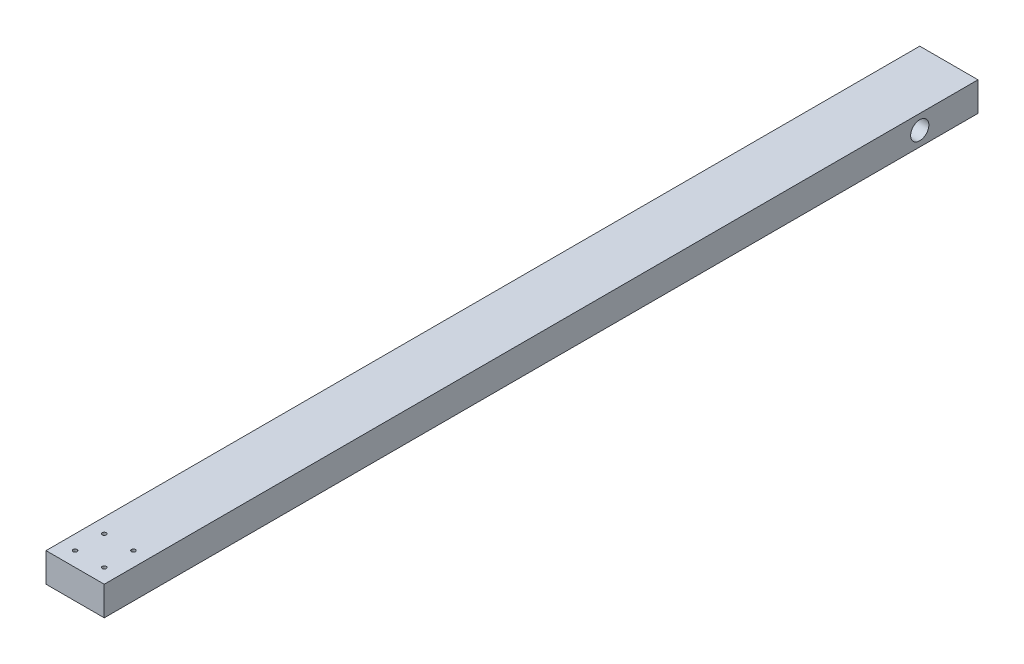
from build123d import *

# Parameters (mm, degrees)
SKETCH1_W           = 101.6
SKETCH1_H           = 50.8
BOSS_EXTRUDE1_DEPTH = 1524
SKETCH2_R           = 3.4925
CUT_EXTRUDE1_DEPTH  = 50.8
SKETCH3_R           = 15.875
CUT_EXTRUDE2_DEPTH  = 101.6


with BuildPart() as part:
    # Sketch1 → Boss-Extrude1 (new body)
    with BuildSketch(Plane.XY):
        Rectangle(SKETCH1_W, SKETCH1_H)
    extrude(amount=BOSS_EXTRUDE1_DEPTH)

    # Sketch2 → Cut-Extrude1 (cut)
    with BuildSketch(Plane(origin=(0, 25.4, 0), x_dir=(1, 0, 0), z_dir=(0, 1, 0))):
        with Locations(Location((-25.4, -1447.8, 0), (0, 0, 270))):
            Circle(SKETCH2_R)
        with Locations(Location((25.4, -1447.8, 0), (0, 0, 270))):
            Circle(SKETCH2_R)
        with Locations(Location((25.4, -1498.6, 0), (0, 0, 270))):
            Circle(SKETCH2_R)
        with Locations(Location((-25.4, -1498.6, 0), (0, 0, 270))):
            Circle(SKETCH2_R)
    extrude(amount=-CUT_EXTRUDE1_DEPTH, mode=Mode.SUBTRACT)

    # Sketch3 → Cut-Extrude2 (cut)
    with BuildSketch(Plane(origin=(50.8, 0, 0), x_dir=(0, 0, -1), z_dir=(1, 0, 0))):
        with Locations((-101.6, 0)):
            Circle(SKETCH3_R)
    extrude(amount=-CUT_EXTRUDE2_DEPTH, mode=Mode.SUBTRACT)


solid = part.part
